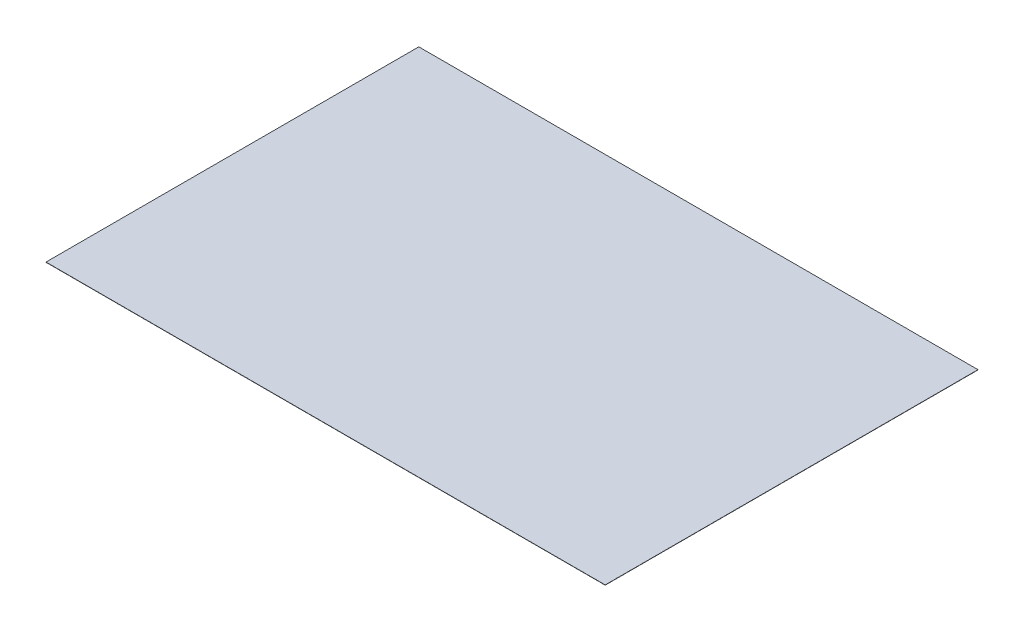
from build123d import *

# Parameters (mm, degrees)
SKETCH1_W           = 24000
SKETCH1_H           = 16000
BOSS_EXTRUDE1_DEPTH = 10


with BuildPart() as part:
    # Sketch1 → Boss-Extrude1 (new body)
    with BuildSketch(Plane(origin=(0, 0, 0), x_dir=(1, 0, 0), z_dir=(0, 1, 0))):
        with Locations((12000, 8000)):
            Rectangle(SKETCH1_W, SKETCH1_H)
    extrude(amount=BOSS_EXTRUDE1_DEPTH)


solid = part.part
